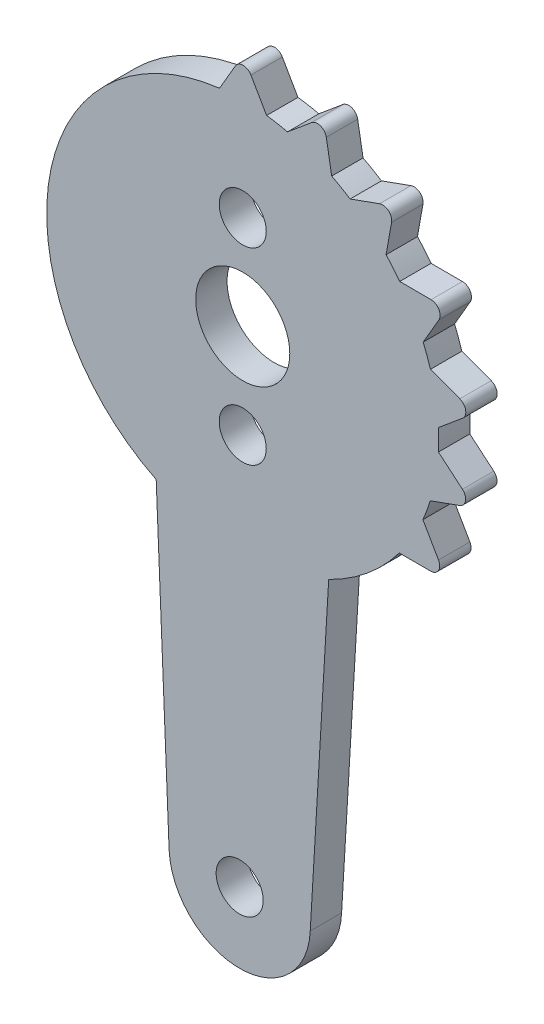
from build123d import *

# Parameters (mm, degrees)
SKETCH1_R           = 3
SKETCH1_R_2         = 1.5
BOSS_EXTRUDE1_DEPTH = 2


with BuildPart() as part:
    # Sketch1 → Boss-Extrude1 (new body)
    with BuildSketch(Plane.XY):
        with BuildLine():
            Line((-5.322767432, 19.832757644), (-4.500006862, -0.184957582))
            ThreePointArc((-4.500006862, -0.184957582), (-0.000167017, -4.503806283), (4.499993132, -0.185291335))
            Line((4.499993132, -0.185291335), (5.67721776, 19.814708665))
            ThreePointArc((5.67721776, 19.814708665), (8.148561948, 21.404983206), (10.180318916, 23.528301089))
            Line((10.180318916, 23.528301089), (12.180312779, 23.523346368))
            ThreePointArc((12.180312779, 23.523346368), (12.679597114, 23.812434692), (12.680312779, 24.389371772))
            Line((12.680312779, 24.389371772), (11.684612917, 26.123898158))
            ThreePointArc((11.684612917, 26.123898158), (11.934719035, 26.754030681), (12.150293859, 27.396796239))
            Line((12.150293859, 27.396796239), (14.031367948, 28.076178512))
            ThreePointArc((14.031367948, 28.076178512), (14.401667723, 28.518597977), (14.205016126, 29.060986265))
            Line((14.205016126, 29.060986265), (12.67612135, 30.350358501))
            ThreePointArc((12.67612135, 30.350358501), (12.695626208, 31.028030714), (12.678361511, 31.705763698))
            Line((12.678361511, 31.705763698), (14.213630529, 32.987539436))
            ThreePointArc((14.213630529, 32.987539436), (14.410282126, 33.529927724), (14.039982351, 33.972347189))
            Line((14.039982351, 33.972347189), (12.162299935, 34.661047954))
            ThreePointArc((12.162299935, 34.661047954), (11.948850959, 35.304522586), (11.700829119, 35.935478396))
            Line((11.700829119, 35.935478396), (12.705116964, 37.665046528))
            ThreePointArc((12.705116964, 37.665046528), (12.704401299, 38.241983607), (12.205116964, 38.531071932))
            Line((12.205116964, 38.531071932), (10.205123119, 38.536033749))
            ThreePointArc((10.205123119, 38.536033749), (9.784465406, 39.067698263), (9.335601516, 39.575774317))
            Line((9.335601516, 39.575774317), (9.687776253, 41.5445234))
            ThreePointArc((9.687776253, 41.5445234), (9.489779645, 42.086422145), (8.92173181, 42.18731101))
            Line((8.92173181, 42.18731101), (7.040655311, 41.507935412))
            ThreePointArc((7.040655311, 41.507935412), (6.463526388, 41.863663221), (5.867960059, 42.187578047))
            Line((5.867960059, 42.187578047), (5.525544216, 44.158047887))
            ThreePointArc((5.525544216, 44.158047887), (5.154147979, 44.59954731), (4.585851596, 44.500068031))
            Line((4.585851596, 44.500068031), (3.050578029, 43.21829774))
            ThreePointArc((3.050578029, 43.21829774), (2.386588163, 43.355182821), (1.716153483, 43.455867511))
            Line((1.716153483, 43.455867511), (0.720447466, 45.190390364))
            ThreePointArc((0.720447466, 45.190390364), (0.220447466, 45.47823912), (-0.279552534, 45.190390364))
            Line((-0.279552534, 45.190390364), (-1.283846517, 43.460825796))
            ThreePointArc((-1.283846517, 43.460825796), (-12.125641313, 33.154858755), (-5.322767432, 19.832757644))
        make_face()
        with Locations((0.19564328, 31.048690205)):
            Circle(SKETCH1_R, mode=Mode.SUBTRACT)
        with Locations((0.19564328, 37.048690205)):
            Circle(SKETCH1_R_2, mode=Mode.SUBTRACT)
        with Locations((0.19564328, 25.048690205)):
            Circle(SKETCH1_R_2, mode=Mode.SUBTRACT)
        Circle(SKETCH1_R_2, mode=Mode.SUBTRACT)
    extrude(amount=BOSS_EXTRUDE1_DEPTH)


solid = part.part
